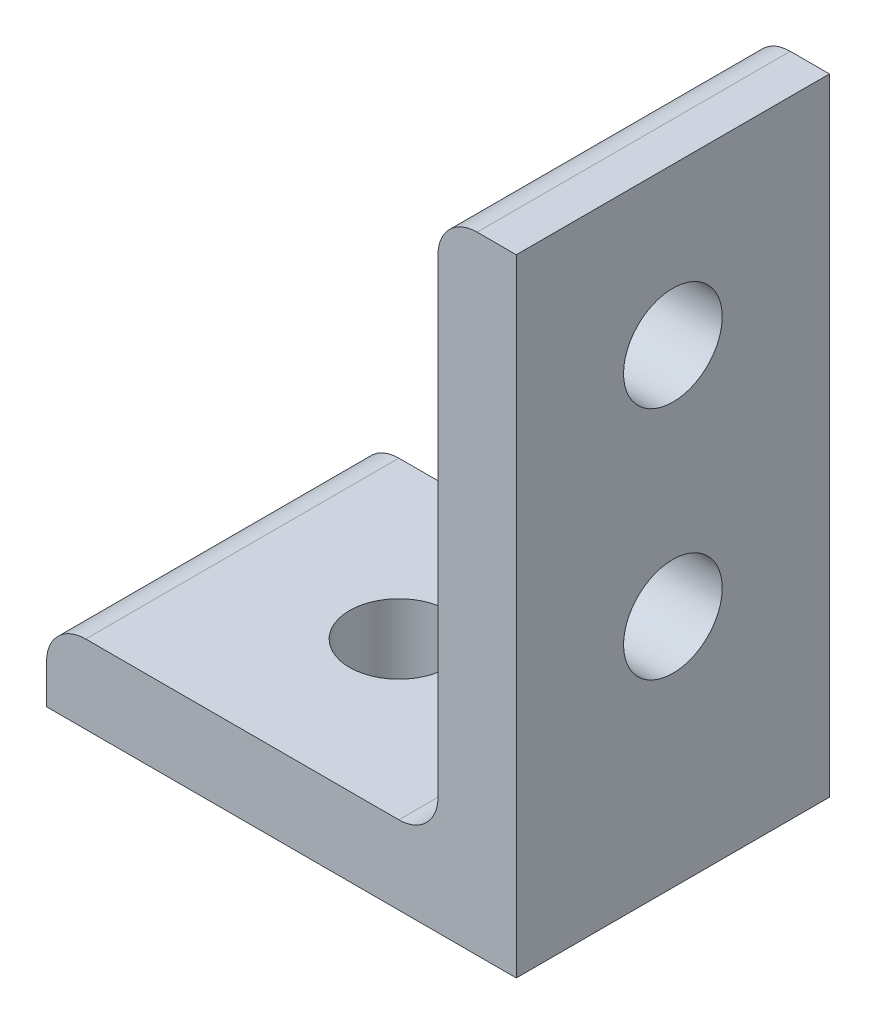
from build123d import *

# Parameters (mm, degrees)
BOSS_EXTRUDE1_DEPTH = 12.7
SKETCH3_R           = 4
CUT_EXTRUDE1_DEPTH  = 50.99995
SKETCH4_R           = 4
CUT_EXTRUDE2_DEPTH  = 62.237182332


with BuildPart() as part:
    # Sketch2 → Boss-Extrude1 (new, symmetric)
    with BuildSketch(Plane.XY):
        with BuildLine():
            Line((-19.05, 0), (19.05, 0))
            Line((19.05, 0), (19.05, 50.8))
            Line((19.05, 50.8), (15.875, 50.8))
            ThreePointArc((15.875, 50.8), (13.62993597, 49.87006403), (12.7, 47.625))
            Line((12.7, 47.625), (12.7, 9.525))
            ThreePointArc((12.7, 9.525), (11.77006403, 7.27993597), (9.525, 6.35))
            Line((9.525, 6.35), (-15.875, 6.35))
            ThreePointArc((-15.875, 6.35), (-18.12006403, 5.42006403), (-19.05, 3.175))
            Line((-19.05, 3.175), (-19.05, 0))
        make_face()
    extrude(amount=BOSS_EXTRUDE1_DEPTH, both=True)

    # Sketch3 → Cut-Extrude1 (cut, through all)
    with BuildSketch(Plane(origin=(0, 6.35, 0), x_dir=(1, 0, 0), z_dir=(0, 1, 0))):
        with Locations(Location((-3.175, 0, 0), (0, 0, 180))):
            Circle(SKETCH3_R)
    extrude(amount=-CUT_EXTRUDE1_DEPTH, mode=Mode.SUBTRACT)

    # Sketch4 → Cut-Extrude2 (cut, through all)
    with BuildSketch(Plane.ZY.offset(-12.7)):
        with Locations(Location((0, 38.1, 0), (0, 0, 270))):
            Circle(SKETCH4_R)
        with Locations(Location((0, 19.05, 0), (0, 0, 90))):
            Circle(SKETCH4_R)
    extrude(amount=-CUT_EXTRUDE2_DEPTH, mode=Mode.SUBTRACT)


solid = part.part
